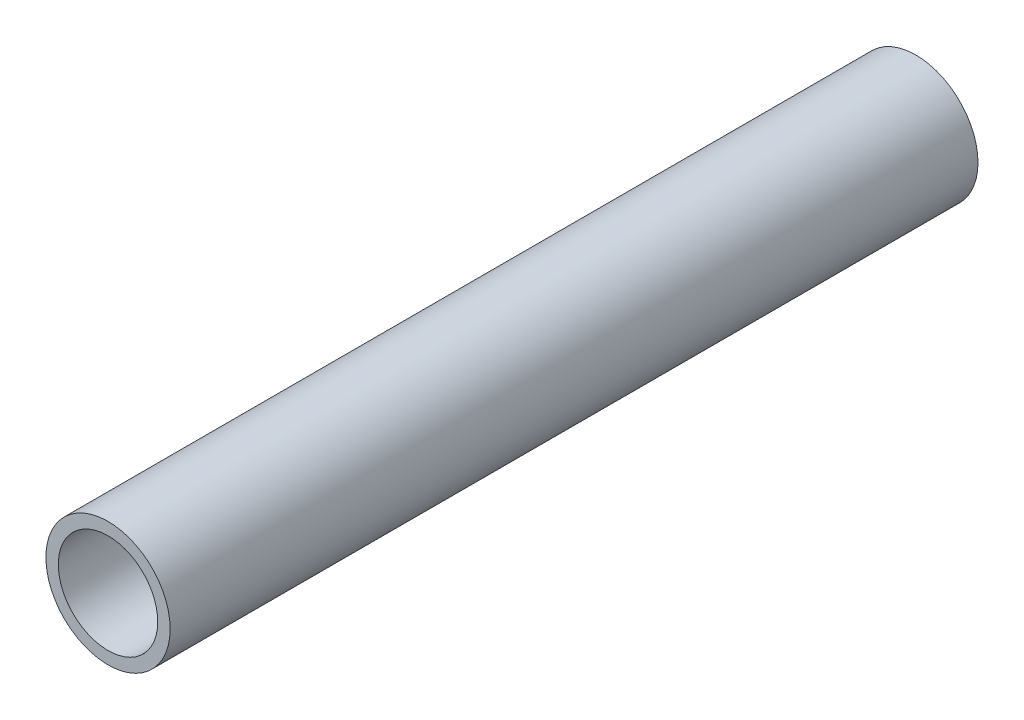
from build123d import *

# Parameters (mm, degrees)
SKETCH1_R           = 5
SKETCH1_R_2         = 4
BOSS_EXTRUDE1_DEPTH = 32.5


with BuildPart() as part:
    # Sketch1 → Boss-Extrude1 (new, symmetric)
    with BuildSketch(Plane.XY):
        Circle(SKETCH1_R)
        Circle(SKETCH1_R_2, mode=Mode.SUBTRACT)
    extrude(amount=BOSS_EXTRUDE1_DEPTH, both=True)


solid = part.part
